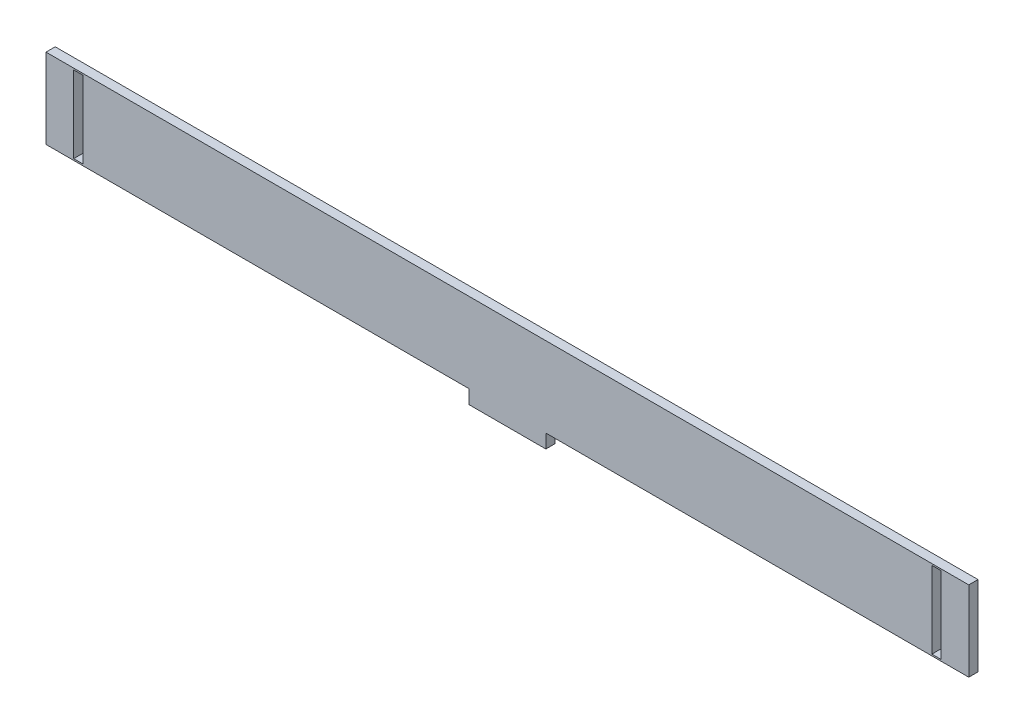
from build123d import *

# Parameters (mm, degrees)
SKETCH1_W           = 6
SKETCH1_H           = 50
BOSS_EXTRUDE1_DEPTH = 6


with BuildPart() as part:
    # Sketch1 → Boss-Extrude1 (new body)
    with BuildSketch(Plane.XY):
        Polygon((0, 0), (600, 0), (600, -52), (325, -52), (325, -61), (275, -61), (275, -52), (0, -52), align=None)
        with Locations((579, -26)):
            Rectangle(SKETCH1_W, SKETCH1_H, mode=Mode.SUBTRACT)
        with Locations((21, -26)):
            Rectangle(SKETCH1_W, SKETCH1_H, mode=Mode.SUBTRACT)
    extrude(amount=BOSS_EXTRUDE1_DEPTH)


solid = part.part
